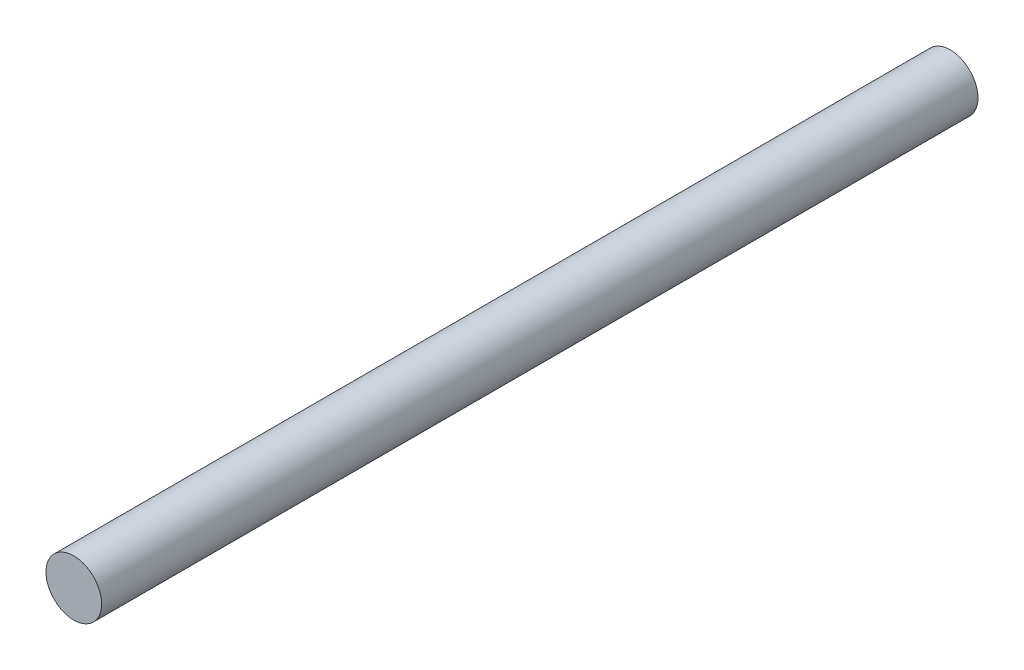
from build123d import *

# Parameters (mm, degrees)
SKETCH1_R           = 9.525
BOSS_EXTRUDE1_DEPTH = 300


with BuildPart() as part:
    # Sketch1 → Boss-Extrude1 (new body)
    with BuildSketch(Plane.XY):
        with Locations((125.614886662, 32.835787286)):
            Circle(SKETCH1_R)
    extrude(amount=BOSS_EXTRUDE1_DEPTH)


solid = part.part
